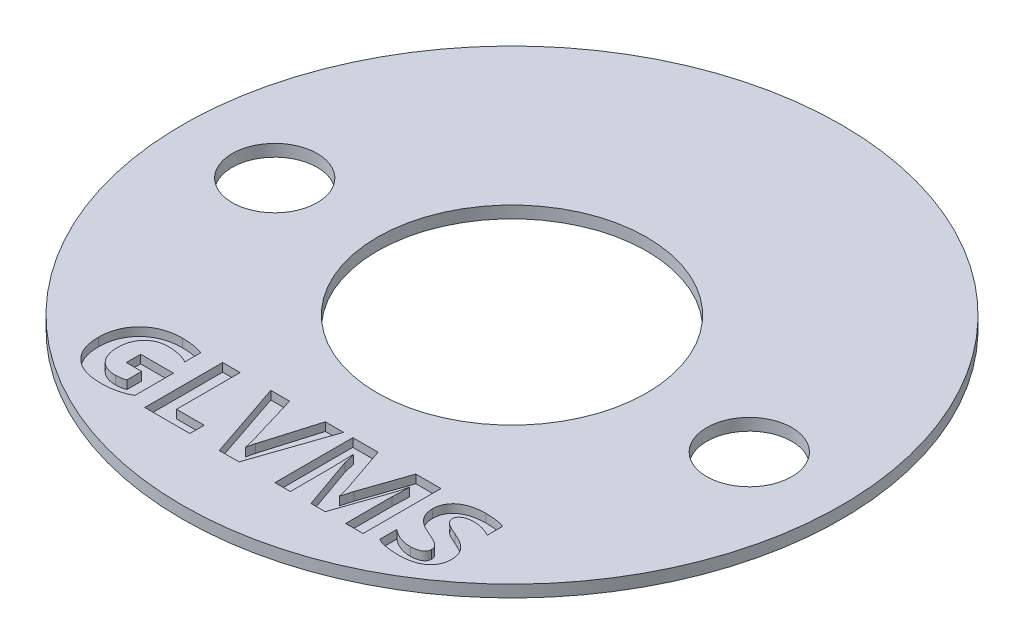
from build123d import *

# Parameters (mm, degrees)
SKETCH1_R           = 27.5
BOSS_EXTRUDE1_DEPTH = 1
SKETCH4_R           = 3.55
SKETCH4_R_2         = 11.25
CUT_EXTRUDE2_DEPTH  = 39.903727328
CUT_EXTRUDE1_DEPTH  = 0.7


with BuildPart() as part:
    # Sketch1 → Boss-Extrude1 (new body)
    with BuildSketch(Plane(origin=(0, 0, 0), x_dir=(1, 0, 0), z_dir=(0, 1, 0))):
        with Locations(Location((0, 0, 0), (0, 0, 270))):
            Circle(SKETCH1_R)
    extrude(amount=BOSS_EXTRUDE1_DEPTH)

    # Sketch4 → Cut-Extrude2 (cut, through all)
    with BuildSketch(Plane.XZ):
        with Locations(Location((-19.8, 0, 0), (0, 0, 270))):
            Circle(SKETCH4_R)
        with Locations(Location((0, 0, 0), (0, 0, 270))):
            Circle(SKETCH4_R_2)
        with Locations(Location((19.8, 0, 0), (0, 0, 270))):
            Circle(SKETCH4_R)
    extrude(amount=-CUT_EXTRUDE2_DEPTH, mode=Mode.SUBTRACT)

    # Sketch2 → Cut-Extrude1 (cut)
    with BuildSketch(Plane(origin=(0, 1, 0), x_dir=(1, 0, 0), z_dir=(0, 1, 0))):
        with BuildLine():
            add(Edge.make_bspline(
                [(-9.927631579, -21.544305099), (-10.008465605, -21.588024998), (-10.171869957, -21.676403892), (-10.432927409, -21.784591366), (-10.70682122, -21.878488314), (-10.995755164, -21.954881433), (-11.299092833, -22.012728122), (-11.616225118, -22.055554176), (-11.947755415, -22.081466791), (-12.173540933, -22.084153105), (-12.288959704, -22.085526316)],
                knots=[0, 0, 0, 0, 0.899883021, 1.819095354, 2.764509757, 3.73526241, 4.7444104, 5.788148441, 6.86932877, 8, 8, 8, 8], degree=3))
            add(Edge.make_bspline(
                [(-12.288959704, -22.085526316), (-12.416014451, -22.08305987), (-12.663660304, -22.078252453), (-13.025031856, -22.037985294), (-13.365434074, -21.969434059), (-13.686632728, -21.877240036), (-13.985658725, -21.754566649), (-14.265100764, -21.60740093), (-14.522672657, -21.430909489), (-14.759550005, -21.229648065), (-14.970822866, -21.003384989), (-15.155120979, -20.756028255), (-15.311341865, -20.488058331), (-15.437990411, -20.199505121), (-15.537432874, -19.891024439), (-15.607821557, -19.5624776), (-15.649255699, -19.213437996), (-15.654967629, -18.974174374), (-15.657894737, -18.8515625)],
                knots=[0, 0, 0, 0, 1.152559309, 2.246484612, 3.293534839, 4.300050713, 5.273476125, 6.220871245, 7.16026709, 8.10057537, 9.035614067, 9.9627583, 10.893700231, 11.843686631, 12.816331445, 13.82942278, 14.887676536, 16, 16, 16, 16], degree=3))
            add(Edge.make_bspline(
                [(-15.657894737, -18.8515625), (-15.655441, -18.727564519), (-15.650629802, -18.484433772), (-15.602022354, -18.129354375), (-15.526482507, -17.791294028), (-15.419636746, -17.470829604), (-15.28117874, -17.167970815), (-15.111590134, -16.883544536), (-14.912752142, -16.615443834), (-14.683325134, -16.368218749), (-14.428771491, -16.144052897), (-14.152353094, -15.947569763), (-13.85482788, -15.782752868), (-13.538000648, -15.646964617), (-13.200492507, -15.543022852), (-12.843058594, -15.468700144), (-12.465697261, -15.422120953), (-12.207134868, -15.417058146), (-12.075143914, -15.414473684)],
                knots=[0, 0, 0, 0, 1.064498478, 2.08723003, 3.072042363, 4.036357981, 4.983154936, 5.926745839, 6.875635575, 7.844940443, 8.818201751, 9.78426919, 10.751986953, 11.734172093, 12.739834969, 13.779897015, 14.866681632, 16, 16, 16, 16], degree=3))
            add(Edge.make_bspline(
                [(-12.075143914, -15.414473684), (-11.990933116, -15.415089365), (-11.825073515, -15.416301994), (-11.580396411, -15.430484033), (-11.343158893, -15.451269724), (-11.113490169, -15.481867998), (-10.891522845, -15.522076631), (-10.677166942, -15.570514659), (-10.46970989, -15.625420519), (-10.335868997, -15.671166836), (-10.269736842, -15.693770559)],
                knots=[0, 0, 0, 0, 1.100833006, 2.168174692, 3.203186668, 4.213792841, 5.196200773, 6.151300635, 7.086538723, 8, 8, 8, 8], degree=3))
            Line((-10.269736842, -15.693770559), (-10.269736842, -17.039473684))
            add(Edge.make_bspline(
                [(-10.269736842, -17.039473684), (-10.332940865, -17.005073328), (-10.460133066, -16.935845819), (-10.662311472, -16.849061295), (-10.874611369, -16.775962665), (-11.097385702, -16.715636939), (-11.33002668, -16.669172884), (-11.57322887, -16.635873158), (-11.826679577, -16.615547932), (-11.999379432, -16.613091054), (-12.087171053, -16.611842105)],
                knots=[0, 0, 0, 0, 0.91419245, 1.839727045, 2.792244737, 3.765978492, 4.770816306, 5.805281766, 6.884319448, 8, 8, 8, 8], degree=3))
            add(Edge.make_bspline(
                [(-12.087171053, -16.611842105), (-12.160328586, -16.613528184), (-12.304080525, -16.616841269), (-12.514173102, -16.646171926), (-12.714862854, -16.690261245), (-12.903745694, -16.757000469), (-13.083446391, -16.839317646), (-13.25072774, -16.943923775), (-13.409567537, -17.064200305), (-13.555643468, -17.203024159), (-13.688471564, -17.35651693), (-13.803428013, -17.524475484), (-13.901899759, -17.704130718), (-13.980412391, -17.897321957), (-14.043741589, -18.101890256), (-14.087438, -18.319480021), (-14.11264094, -18.548950225), (-14.11646509, -18.705837347), (-14.118421053, -18.786081414)],
                knots=[0, 0, 0, 0, 1.04790768, 2.059101158, 3.034747588, 3.98767762, 4.924454577, 5.861688218, 6.809085269, 7.775477291, 8.744185945, 9.712789417, 10.686930928, 11.674472254, 12.696250236, 13.751675729, 14.850035091, 16, 16, 16, 16], degree=3))
            add(Edge.make_bspline(
                [(-14.118421053, -18.786081414), (-14.116959677, -18.867215214), (-14.114110433, -19.02540178), (-14.08976095, -19.255523432), (-14.050036298, -19.47194273), (-13.994096284, -19.674225561), (-13.92244062, -19.862907881), (-13.831663765, -20.03587166), (-13.727738745, -20.196232554), (-13.607028612, -20.340663426), (-13.472702021, -20.469258398), (-13.327076855, -20.582771891), (-13.167956492, -20.67556101), (-12.999807427, -20.754469942), (-12.819468506, -20.81460644), (-12.627666952, -20.856341116), (-12.425210979, -20.88458891), (-12.286386906, -20.886951055), (-12.215460526, -20.888157895)],
                knots=[0, 0, 0, 0, 1.211779253, 2.362605976, 3.452423369, 4.49540014, 5.493931875, 6.461242594, 7.408079423, 8.343600711, 9.266061143, 10.181800419, 11.094803428, 12.011799128, 12.952442201, 13.927572417, 14.941179423, 16, 16, 16, 16], degree=3))
            add(Edge.make_bspline(
                [(-12.215460526, -20.888157895), (-12.132521669, -20.88642611), (-11.974637139, -20.883129441), (-11.751705422, -20.857040379), (-11.554468641, -20.813553488), (-11.43721578, -20.76626891), (-11.381578947, -20.743832237)],
                knots=[0, 0, 0, 0, 1.167448492, 2.222384808, 3.156516285, 4, 4, 4, 4], degree=3))
            Line((-11.381578947, -20.743832237), (-11.381578947, -19.519736842))
            Line((-11.381578947, -19.519736842), (-12.664473684, -19.519736842))
            Line((-12.664473684, -19.519736842), (-12.664473684, -18.322368421))
            Line((-12.664473684, -18.322368421), (-9.927631579, -18.322368421))
            Line((-9.927631579, -18.322368421), (-9.927631579, -21.544305099))
        make_face()
        Polygon((-4.881578947, -22), (-8.644736842, -22), (-8.644736842, -15.5), (-7.190789474, -15.5), (-7.190789474, -20.802631579), (-4.881578947, -20.802631579), align=None)
        with BuildLine():
            Line((1.447368421, -15.5), (-0.777652138, -22))
            Line((-0.777652138, -22), (-2.426706414, -22))
            Line((-2.426706414, -22), (-4.625, -15.5))
            Line((-4.625, -15.5), (-3.057462993, -15.5))
            Line((-3.057462993, -15.5), (-1.71042352, -20.023540296))
            add(Edge.make_bspline(
                [(-1.71042352, -20.023540296), (-1.693179451, -20.082593797), (-1.659812651, -20.196860696), (-1.623972588, -20.36508088), (-1.593619877, -20.521601983), (-1.584052314, -20.623009384), (-1.579461349, -20.671669408)],
                knots=[0, 0, 0, 0, 1.11409259, 2.155738524, 3.115036891, 4, 4, 4, 4], degree=3))
            Line((-1.579461349, -20.671669408), (-1.552734375, -20.671669408))
            add(Edge.make_bspline(
                [(-1.552734375, -20.671669408), (-1.546011436, -20.61993889), (-1.532171163, -20.513443119), (-1.50284003, -20.350015264), (-1.462223442, -20.179554808), (-1.43016131, -20.063976472), (-1.413754112, -20.004831414)],
                knots=[0, 0, 0, 0, 0.917840517, 1.889525518, 2.920004058, 4, 4, 4, 4], degree=3))
            Line((-1.413754112, -20.004831414), (-0.07473273, -15.5))
            Line((-0.07473273, -15.5), (1.447368421, -15.5))
        make_face()
        with BuildLine():
            Line((9.572368421, -22), (8.118421053, -22))
            Line((8.118421053, -22), (8.118421053, -18.111225329))
            add(Edge.make_bspline(
                [(8.118421053, -18.111225329), (8.119463213, -18.003422509), (8.121603848, -17.781991748), (8.130609691, -17.442012924), (8.148448461, -17.085627017), (8.164824435, -16.843007153), (8.173211349, -16.71875)],
                knots=[0, 0, 0, 0, 0.928152517, 1.906457722, 2.927797591, 4, 4, 4, 4], degree=3))
            Line((8.173211349, -16.71875), (8.137129934, -16.71875))
            add(Edge.make_bspline(
                [(8.137129934, -16.71875), (8.127799442, -16.766862781), (8.10982049, -16.859571442), (8.083387884, -16.993810433), (8.056551859, -17.117089289), (8.031414873, -17.23040883), (8.00574741, -17.332697272), (7.982272462, -17.425198967), (7.958099967, -17.506595691), (7.941672007, -17.557116431), (7.934004934, -17.580694901)],
                knots=[0, 0, 0, 0, 1.327313991, 2.557605269, 3.705207991, 4.744183751, 5.700973686, 6.5612476, 7.3285217, 8, 8, 8, 8], degree=3))
            Line((7.934004934, -17.580694901), (6.418585526, -22))
            Line((6.418585526, -22), (5.227898849, -22))
            Line((5.227898849, -22), (3.685752467, -17.626130757))
            add(Edge.make_bspline(
                [(3.685752467, -17.626130757), (3.679718083, -17.608831391), (3.665637108, -17.568464071), (3.648484474, -17.497898354), (3.626387766, -17.410334876), (3.603033677, -17.305472131), (3.576054013, -17.183476876), (3.546691976, -17.04403701), (3.514602939, -16.887324968), (3.493617077, -16.776687317), (3.482627467, -16.71875)],
                knots=[0, 0, 0, 0, 0.472413095, 1.102355455, 1.871602873, 2.802702045, 3.873391322, 5.094959742, 6.47872549, 8, 8, 8, 8], degree=3))
            Line((3.482627467, -16.71875), (3.442537007, -16.71875))
            add(Edge.make_bspline(
                [(3.442537007, -16.71875), (3.451512758, -16.87418684), (3.468866993, -17.174717371), (3.485718648, -17.611341785), (3.497174535, -18.01806603), (3.499083198, -18.279598351), (3.5, -18.405222039)],
                knots=[0, 0, 0, 0, 1.107032083, 2.140399523, 3.106764814, 4, 4, 4, 4], degree=3))
            Line((3.5, -18.405222039), (3.5, -22))
            Line((3.5, -22), (2.217105263, -22))
            Line((2.217105263, -22), (2.217105263, -15.5))
            Line((2.217105263, -15.5), (4.320518092, -15.5))
            Line((4.320518092, -15.5), (5.642166941, -19.352693257))
            add(Edge.make_bspline(
                [(5.642166941, -19.352693257), (5.667402524, -19.429534187), (5.717693472, -19.582667291), (5.779684238, -19.815226308), (5.832676228, -20.047811497), (5.85894358, -20.203805209), (5.872018914, -20.281455592)],
                knots=[0, 0, 0, 0, 1.012979573, 2.018724972, 3.013763031, 4, 4, 4, 4], degree=3))
            Line((5.872018914, -20.281455592), (5.898745888, -20.281455592))
            add(Edge.make_bspline(
                [(5.898745888, -20.281455592), (5.918677287, -20.194453265), (5.957333479, -20.025715558), (6.02263175, -19.782976028), (6.085219085, -19.556334318), (6.132507244, -19.41266329), (6.155324836, -19.343338816)],
                knots=[0, 0, 0, 0, 1.100720075, 2.134804773, 3.100001708, 4, 4, 4, 4], degree=3))
            Line((6.155324836, -19.343338816), (7.476973684, -15.5))
            Line((7.476973684, -15.5), (9.572368421, -15.5))
            Line((9.572368421, -15.5), (9.572368421, -22))
        make_face()
        with BuildLine():
            Line((10.684210526, -21.72604852), (10.684210526, -20.289473684))
            add(Edge.make_bspline(
                [(10.684210526, -20.289473684), (10.750972774, -20.344188934), (10.88294474, -20.452347051), (11.095561766, -20.591115516), (11.315623781, -20.71001818), (11.543830053, -20.805403848), (11.776726709, -20.880763679), (12.01158009, -20.933694233), (12.247640771, -20.967619991), (12.405314452, -20.971660738), (12.484272204, -20.973684211)],
                knots=[0, 0, 0, 0, 1.052804814, 2.08112707, 3.092934838, 4.101597725, 5.095309197, 6.076510114, 7.036780032, 8, 8, 8, 8], degree=3))
            add(Edge.make_bspline(
                [(12.484272204, -20.973684211), (12.529293643, -20.973477518), (12.616359454, -20.9730778), (12.742060894, -20.961370885), (12.859154193, -20.94618485), (12.967503838, -20.923092555), (13.067700188, -20.895566542), (13.159338727, -20.86202374), (13.241983713, -20.823444156), (13.316598901, -20.780561289), (13.382016022, -20.732584572), (13.438836919, -20.680375528), (13.48603982, -20.623446094), (13.537863531, -20.543663794), (13.581873161, -20.432106591), (13.588687108, -20.338011829), (13.592105263, -20.290810033)],
                knots=[0, 0, 0, 0, 1.302764252, 2.519382516, 3.651968008, 4.719312502, 5.723721354, 6.658045591, 7.540747622, 8.361350842, 9.145473591, 9.884614119, 10.589667965, 11.280062621, 12.635567738, 14, 14, 14, 14], degree=3))
            add(Edge.make_bspline(
                [(13.592105263, -20.290810033), (13.59084765, -20.25997207), (13.588377373, -20.199398327), (13.568001493, -20.111022196), (13.532421543, -20.028974033), (13.484512288, -19.951631438), (13.425087472, -19.878233023), (13.355622181, -19.807648429), (13.275865909, -19.74029614), (13.152694938, -19.653302777), (12.975748222, -19.54775519), (12.735445566, -19.432171656), (12.469619744, -19.31429187), (12.283552685, -19.237352446), (12.187602796, -19.197676809)],
                knots=[0, 0, 0, 0, 0.590934481, 1.160748317, 1.727158715, 2.298507061, 2.900148301, 3.534378593, 4.194980596, 4.898998642, 6.423979724, 8.139194984, 10.009084388, 12, 12, 12, 12], degree=3))
            add(Edge.make_bspline(
                [(12.187602796, -19.197676809), (12.126303043, -19.17109541), (12.006506913, -19.119148238), (11.835129958, -19.032893283), (11.67491442, -18.944235596), (11.526939041, -18.850434485), (11.391863881, -18.751509678), (11.268506815, -18.64808955), (11.155878495, -18.541920664), (11.056129602, -18.43018436), (10.968566753, -18.312988169), (10.892298997, -18.190158763), (10.827791004, -18.061355383), (10.775599862, -17.926536043), (10.733957743, -17.786288337), (10.704667637, -17.639602069), (10.686895049, -17.487149218), (10.685113857, -17.383409336), (10.684210526, -17.330797697)],
                knots=[0, 0, 0, 0, 1.250860862, 2.444517047, 3.590871071, 4.678394788, 5.722744029, 6.723411862, 7.690959296, 8.618453783, 9.5242799, 10.426990097, 11.322232235, 12.217513229, 13.130682761, 14.058177248, 15.015205389, 16, 16, 16, 16], degree=3))
            add(Edge.make_bspline(
                [(10.684210526, -17.330797697), (10.686866557, -17.24958618), (10.692018759, -17.092051084), (10.729154508, -16.864521582), (10.793392964, -16.654859183), (10.884428989, -16.463914802), (10.995334104, -16.288854456), (11.128364924, -16.132191858), (11.276630274, -15.98883825), (11.445624892, -15.865185708), (11.628875816, -15.755197728), (11.827410917, -15.661820169), (12.039639546, -15.584552959), (12.264433222, -15.521863248), (12.499596297, -15.474928872), (12.742707765, -15.44009323), (12.992116381, -15.417908638), (13.160863797, -15.415625465), (13.245990954, -15.414473684)],
                knots=[0, 0, 0, 0, 1.081198718, 2.097322509, 3.059813659, 3.991166944, 4.906054364, 5.811353855, 6.721769168, 7.6459357, 8.59302305, 9.564157515, 10.562518314, 11.597307653, 12.668715501, 13.753374479, 14.866656162, 16, 16, 16, 16], degree=3))
            add(Edge.make_bspline(
                [(13.245990954, -15.414473684), (13.328408921, -15.415328313), (13.488416015, -15.416987499), (13.721580055, -15.427349754), (13.939979336, -15.446058754), (14.145582495, -15.471317206), (14.340079544, -15.504592658), (14.525765588, -15.546621391), (14.704475707, -15.593272055), (14.818677206, -15.633727811), (14.875, -15.653680099)],
                knots=[0, 0, 0, 0, 1.195237994, 2.320447403, 3.383723621, 4.373269299, 5.323774543, 6.243759987, 7.133843727, 8, 8, 8, 8], degree=3))
            Line((14.875, -15.653680099), (14.875, -16.953947368))
            add(Edge.make_bspline(
                [(14.875, -16.953947368), (14.818593894, -16.919417089), (14.703339596, -16.848861552), (14.516643328, -16.763029921), (14.320859381, -16.687693178), (14.11843862, -16.628897123), (13.914246425, -16.581321754), (13.711778163, -16.55035981), (13.51498261, -16.530718962), (13.386350431, -16.527761058), (13.323499178, -16.526315789)],
                knots=[0, 0, 0, 0, 0.973185875, 1.988505531, 3.020409709, 4.060289755, 5.089876897, 6.105810916, 7.074476093, 8, 8, 8, 8], degree=3))
            add(Edge.make_bspline(
                [(13.323499178, -16.526315789), (13.243590198, -16.528271218), (13.089942296, -16.53203109), (12.873188209, -16.569942483), (12.682487498, -16.626970822), (12.522236133, -16.70701684), (12.393312838, -16.806893537), (12.311729867, -16.906260816), (12.266162819, -16.993326378), (12.242286127, -17.061787316), (12.226752951, -17.134114289), (12.224725411, -17.183717359), (12.223684211, -17.209189967)],
                knots=[0, 0, 0, 0, 1.666493883, 3.204311803, 4.577720999, 5.808610471, 6.920989002, 7.959277989, 8.462502887, 8.965384053, 9.468694847, 10, 10, 10, 10], degree=3))
            add(Edge.make_bspline(
                [(12.223684211, -17.209189967), (12.224685341, -17.235551094), (12.226656044, -17.287442354), (12.242988379, -17.362801103), (12.270466063, -17.433762827), (12.321804372, -17.525132191), (12.415638219, -17.631338354), (12.556713482, -17.751715683), (12.735560973, -17.86247441), (12.94436318, -17.975041667), (13.186102505, -18.084059425), (13.357634479, -18.15617833), (13.447779605, -18.194078947)],
                knots=[0, 0, 0, 0, 0.477042346, 0.939046667, 1.388484856, 1.850770801, 2.82993316, 3.934162149, 5.200672571, 6.629956823, 8.228942609, 10, 10, 10, 10], degree=3))
            add(Edge.make_bspline(
                [(13.447779605, -18.194078947), (13.510839856, -18.220695676), (13.634854537, -18.273040301), (13.813127728, -18.359594534), (13.983687425, -18.44514729), (14.142444165, -18.537137812), (14.293344004, -18.629163804), (14.43095678, -18.730337502), (14.558758482, -18.835876907), (14.675458745, -18.948012462), (14.779766666, -19.067543538), (14.874198294, -19.193316325), (14.950234994, -19.330644509), (15.017212467, -19.474746561), (15.069870647, -19.629060676), (15.104902536, -19.79555739), (15.128814136, -19.973400477), (15.130639703, -20.096509128), (15.131578947, -20.159847862)],
                knots=[0, 0, 0, 0, 1.182142093, 2.324808002, 3.422600261, 4.4772321, 5.493523657, 6.473934373, 7.424665926, 8.355223432, 9.265842699, 10.163099642, 11.065981044, 11.971547163, 12.905946225, 13.874936649, 14.906666431, 16, 16, 16, 16], degree=3))
            add(Edge.make_bspline(
                [(15.131578947, -20.159847862), (15.129119929, -20.246423805), (15.124377981, -20.413376037), (15.085263732, -20.652638228), (15.021740265, -20.871196294), (14.930054962, -21.067198456), (14.815732888, -21.243154326), (14.683419983, -21.401271052), (14.531678116, -21.541638016), (14.362861122, -21.664634165), (14.177232977, -21.770101447), (13.977487861, -21.859488309), (13.763363074, -21.933562285), (13.535865522, -21.989651833), (13.297734513, -22.03179399), (13.052393605, -22.06221662), (12.800402899, -22.081521047), (12.630414346, -22.084180669), (12.544407895, -22.085526316)],
                knots=[0, 0, 0, 0, 1.135948082, 2.190551571, 3.17297232, 4.114787176, 5.019868708, 5.920575964, 6.814327848, 7.726634493, 8.65648264, 9.611815768, 10.59564518, 11.626721736, 12.684287895, 13.768626863, 14.871027011, 16, 16, 16, 16], degree=3))
            add(Edge.make_bspline(
                [(12.544407895, -22.085526316), (12.455731952, -22.084656233), (12.280876245, -22.08294056), (12.021844618, -22.064606065), (11.76948451, -22.036772954), (11.524802895, -21.999013651), (11.291908199, -21.948401798), (11.073660648, -21.887748169), (10.87163116, -21.814418992), (10.745722779, -21.755052086), (10.684210526, -21.72604852)],
                knots=[0, 0, 0, 0, 1.113719809, 2.196089038, 3.260137412, 4.302409517, 5.30443291, 6.252114794, 7.146074671, 8, 8, 8, 8], degree=3))
        make_face()
    extrude(amount=-CUT_EXTRUDE1_DEPTH, mode=Mode.SUBTRACT)


solid = part.part
